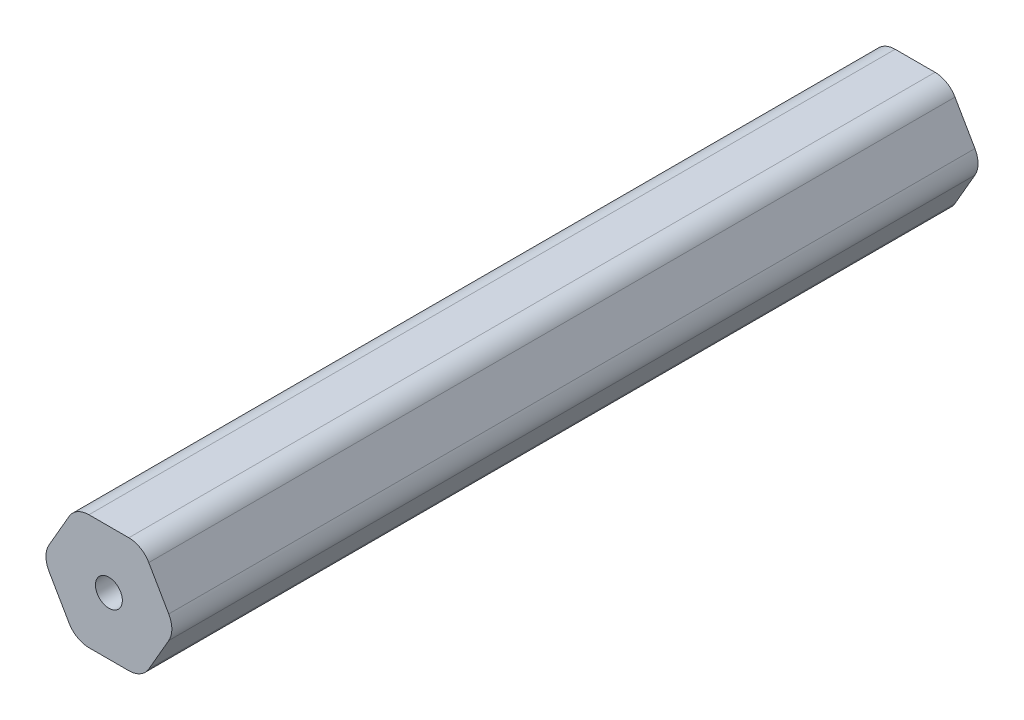
from build123d import *

# Parameters (mm, degrees)
SKETCH1_R           = 1.483161667
BOSS_EXTRUDE1_DEPTH = 88.9
FILLET1_R           = 2.54


with BuildPart() as part:
    # Sketch1 → Boss-Extrude1 (new body)
    with BuildSketch(Plane.XY):
        Polygon((6.273667096, -0.450919823), (2.607492887, 5.899080177), (-4.724855532, 5.899080177), (-8.391029741, -0.450919823), (-4.724855532, -6.800919823), (2.607492887, -6.800919823), align=None)
        with Locations((-1.058681322, -0.450919823)):
            Circle(SKETCH1_R, mode=Mode.SUBTRACT)
    extrude(amount=BOSS_EXTRUDE1_DEPTH)

    # Fillet1
    fillet1_edges = [part.edges().sort_by_distance(p)[0] for p in [
        (2.607492887, -6.800919823, 44.45),
        (-4.724855532, -6.800919823, 44.45),
        (-8.391029741, -0.450919823, 44.45),
        (-4.724855532, 5.899080177, 44.45),
        (2.607492887, 5.899080177, 44.45),
        (6.273667096, -0.450919823, 44.45),
    ]]
    fillet(fillet1_edges, radius=FILLET1_R)


solid = part.part
